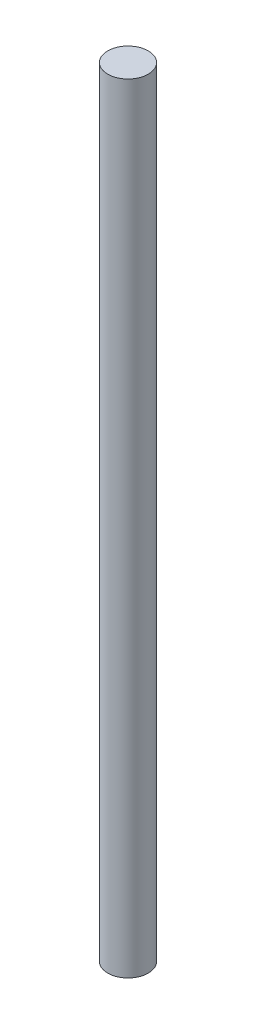
from build123d import *

# Parameters (mm, degrees)
SKETCH1_R           = 12.5
BOSS_EXTRUDE1_DEPTH = 481.306000048


with BuildPart() as part:
    # Sketch1 → Boss-Extrude1 (new body)
    with BuildSketch(Plane(origin=(0, 0, 0), x_dir=(1, 0, 0), z_dir=(0, 1, 0))):
        with Locations(Location((0, 0, 0), (0, 0, 270))):
            Circle(SKETCH1_R)
    extrude(amount=BOSS_EXTRUDE1_DEPTH)


solid = part.part
